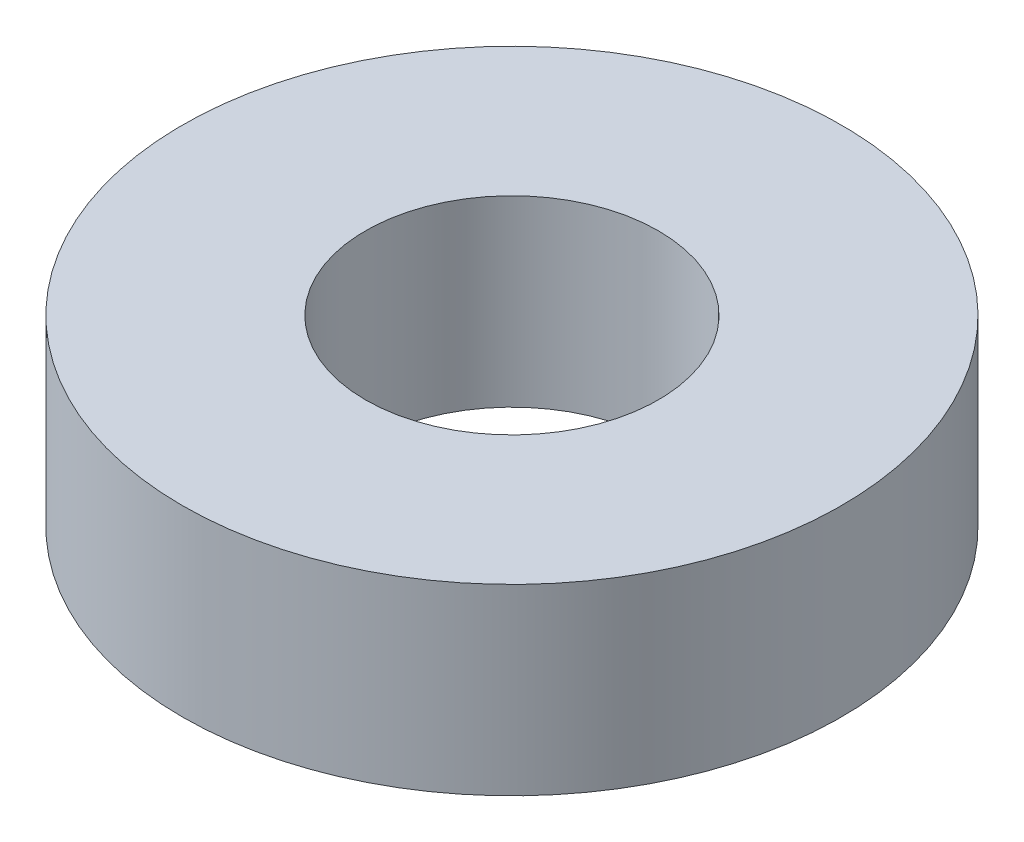
from build123d import *

# Parameters (mm, degrees)
SKETCH2_R           = 4.5
SKETCH2_R_2         = 2
BOSS_EXTRUDE1_DEPTH = 2.5


with BuildPart() as part:
    # Sketch2 → Boss-Extrude1 (new body)
    with BuildSketch(Plane(origin=(0, 0, 0), x_dir=(1, 0, 0), z_dir=(0, 1, 0))):
        with Locations(Location((0, 0, 0), (0, 0, 270))):
            Circle(SKETCH2_R)
        with Locations(Location((0, 0, 0), (0, 0, 270))):
            Circle(SKETCH2_R_2, mode=Mode.SUBTRACT)
    extrude(amount=BOSS_EXTRUDE1_DEPTH)


solid = part.part
